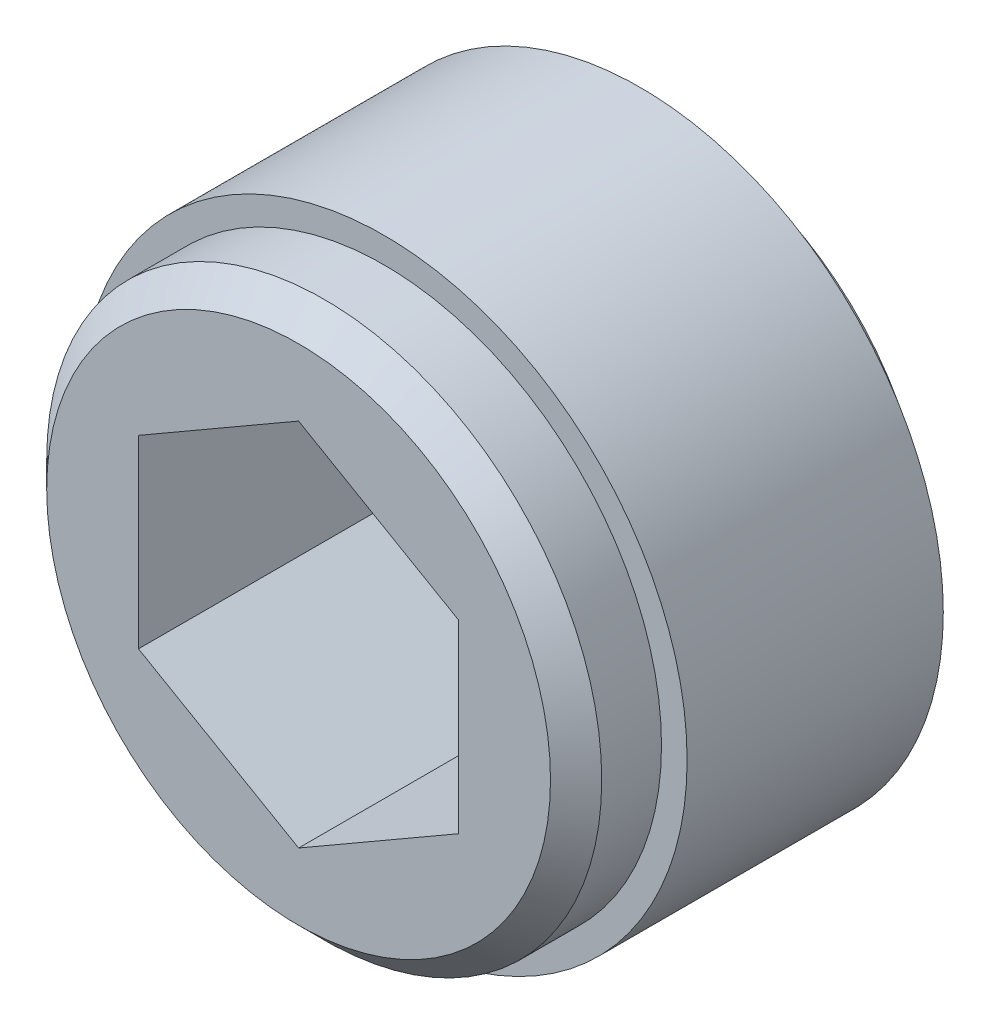
from build123d import *

# Parameters (mm, degrees)
SKETCH1_R           = 4.5085
BOSS_EXTRUDE1_DEPTH = 5.08
SKETCH2_R           = 3.81
BOSS_EXTRUDE2_DEPTH = 0.635
BOSS_EXTRUDE2_TAPER = 15
CUT_EXTRUDE1_START  = -1.27
SKETCH3_R           = 4.5085
SKETCH3_R_2         = 4.1275
CUT_EXTRUDE1_DEPTH  = 1.27
CHAMFER1_SIZE       = 0.381
CUT_EXTRUDE2_DEPTH  = 9.562381132


with BuildPart() as part:
    # Sketch1 → Boss-Extrude1 (new body)
    with BuildSketch(Plane.XY):
        Circle(SKETCH1_R)
    extrude(amount=BOSS_EXTRUDE1_DEPTH)

    # Sketch2 → Boss-Extrude2 (add)
    with BuildSketch(Plane(origin=(0, 0, 0), x_dir=(-1, 0, 0), z_dir=(0, 0, -1))):
        Circle(SKETCH2_R)
    extrude(amount=BOSS_EXTRUDE2_DEPTH, taper=BOSS_EXTRUDE2_TAPER)

    # Sketch3 → Cut-Extrude1 (cut)
    with BuildSketch(Plane.XY.offset(5.08).offset(CUT_EXTRUDE1_START)):
        Circle(SKETCH3_R)
        Circle(SKETCH3_R_2, mode=Mode.SUBTRACT)
    extrude(amount=CUT_EXTRUDE1_DEPTH, mode=Mode.SUBTRACT)

    # Chamfer1
    chamfer1_edges = [part.edges().sort_by_distance(p)[0] for p in [
        (-4.1275, 0, 5.08),
    ]]
    chamfer(chamfer1_edges, length=CHAMFER1_SIZE)

    # Sketch4 → Cut-Extrude2 (cut, through all)
    with BuildSketch(Plane.XY.offset(5.08)):
        Polygon((0, -2.749630657), (2.38125, -1.374815329), (2.38125, 1.374815329), (0, 2.749630657), (-2.38125, 1.374815329), (-2.38125, -1.374815329), align=None)
    extrude(amount=-CUT_EXTRUDE2_DEPTH, mode=Mode.SUBTRACT)


solid = part.part
